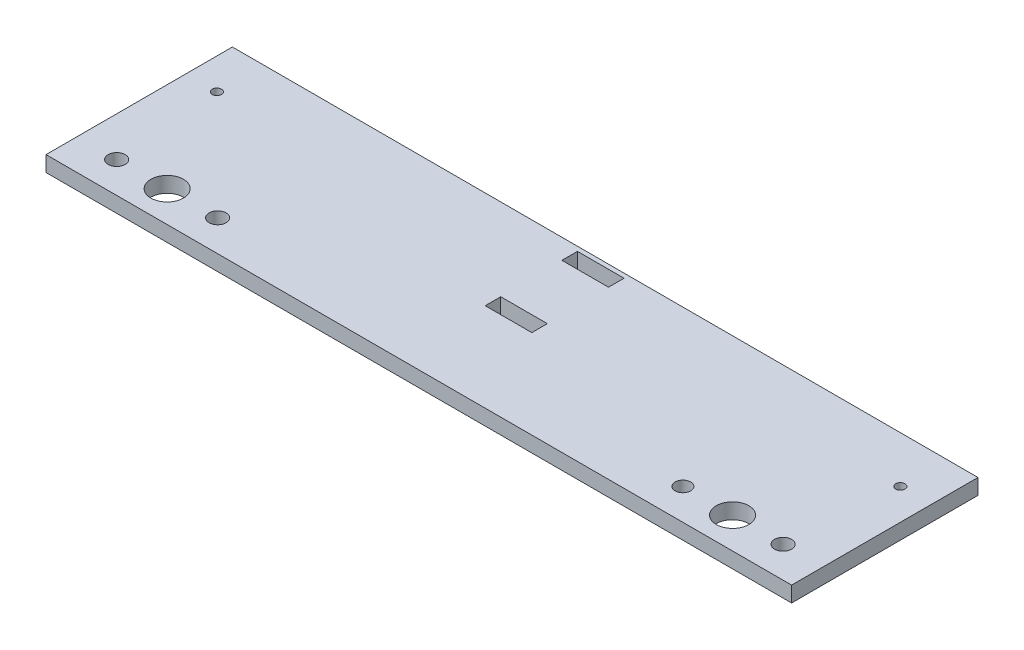
from build123d import *

# Parameters (mm, degrees)
SKETCH1_W           = 240
SKETCH1_H           = 60
SKETCH1_R           = 5.248248104
SKETCH1_R_2         = 1.5
SKETCH1_R_3         = 2.75
SKETCH1_R_4         = 2.5
SKETCH1_W_2         = 15
SKETCH1_H_2         = 5
BOSS_EXTRUDE1_DEPTH = 5


with BuildPart() as part:
    # Sketch1 → Boss-Extrude1 (new body)
    with BuildSketch(Plane(origin=(0, 0, 0), x_dir=(1, 0, 0), z_dir=(0, 1, 0))):
        with Locations((0, -15.214636322)):
            Rectangle(SKETCH1_W, SKETCH1_H)
        with Locations(Location((-91, -35.214636322, 0), (0, 0, 270))):
            Circle(SKETCH1_R, mode=Mode.SUBTRACT)
        with Locations(Location((91, -35.214636322, 0), (0, 0, 90))):
            Circle(SKETCH1_R, mode=Mode.SUBTRACT)
        with Locations(Location((-110, -0.214636322, 0), (0, 0, 270))):
            Circle(SKETCH1_R_2, mode=Mode.SUBTRACT)
        with Locations(Location((110, -0.214636322, 0), (0, 0, 270))):
            Circle(SKETCH1_R_2, mode=Mode.SUBTRACT)
        with Locations(Location((-74.75, -35.214636322, 0), (0, 0, 270))):
            Circle(SKETCH1_R_3, mode=Mode.SUBTRACT)
        with Locations(Location((-107.25, -35.214636322, 0), (0, 0, 270))):
            Circle(SKETCH1_R_3, mode=Mode.SUBTRACT)
        with Locations(Location((107.25, -35.214636322, 0), (0, 0, 270))):
            Circle(SKETCH1_R_3, mode=Mode.SUBTRACT)
        with Locations(Location((75, -35.214636322, 0), (0, 0, 270))):
            Circle(SKETCH1_R_4, mode=Mode.SUBTRACT)
        with Locations((0.310691637, -14.147905604)):
            Rectangle(SKETCH1_W_2, SKETCH1_H_2, mode=Mode.SUBTRACT)
        with Locations((0, 10.852094396)):
            Rectangle(SKETCH1_W_2, SKETCH1_H_2, mode=Mode.SUBTRACT)
    extrude(amount=BOSS_EXTRUDE1_DEPTH)


solid = part.part
